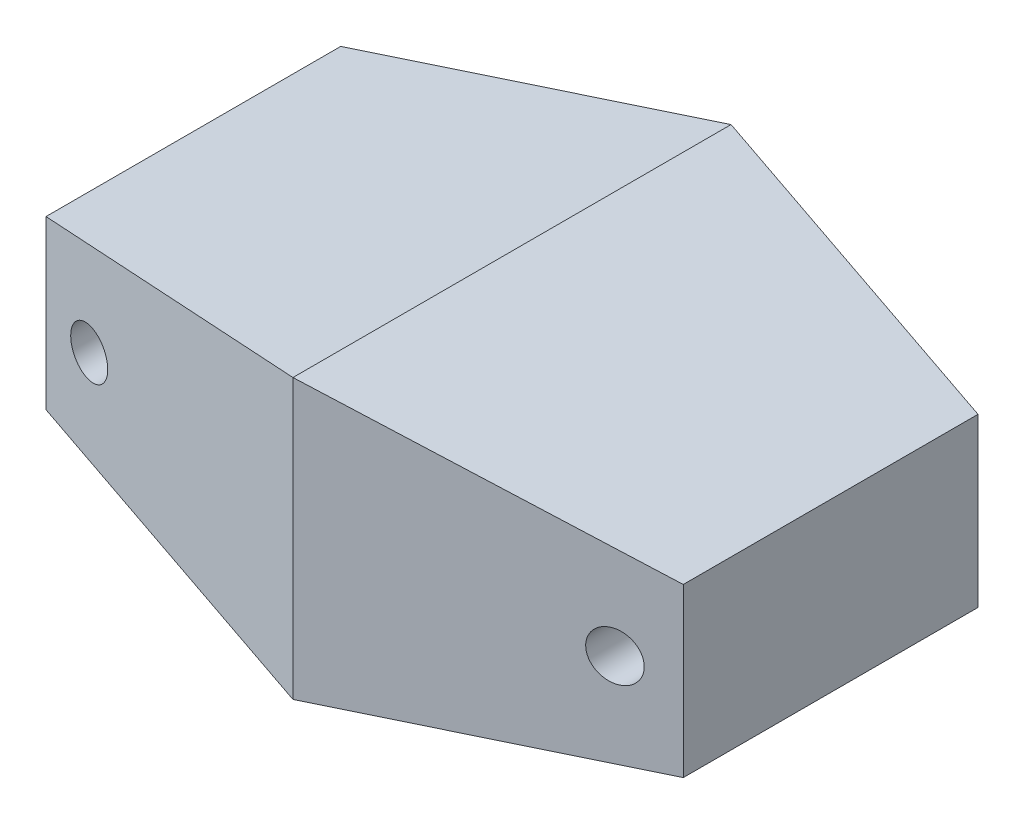
from build123d import *

# Parameters (mm, degrees)
SKETCH1_W               = 80
SKETCH1_H               = 35
BOSS_EXTRUDE1_DEPTH     = 55
CUT_EXTRUDE1_DEPTH      = 55
CUT_EXTRUDE2_DEPTH      = 71.222859526
CUT_EXTRUDE2_DEPTH_BACK = 71.222859526
CUT_EXTRUDE3_DEPTH      = 71.222859526
CUT_EXTRUDE3_DEPTH_BACK = 71.222859526
SKETCH6_R               = 3


with BuildPart() as part:
    # Sketch1 → Boss-Extrude1 (new body)
    with BuildSketch(Plane.XY):
        Rectangle(SKETCH1_W, SKETCH1_H)
    extrude(amount=BOSS_EXTRUDE1_DEPTH)

    # Sketch2 → Cut-Extrude1 (cut)
    with BuildSketch(Plane(origin=(0, 17.5, 0), x_dir=(1, 0, 0), z_dir=(0, 1, 0))):
        Polygon((-40, -55), (0, -55), (-40, -46), align=None)
        Polygon((40, -46), (0, -55), (40, -55), align=None)
        Polygon((0, 0), (40, -9), (40, 0), align=None)
        Polygon((-40, 0), (-40, -9), (0, 0), align=None)
    extrude(amount=-CUT_EXTRUDE1_DEPTH, mode=Mode.SUBTRACT)

    # Sketch5 → Cut-Extrude2 (cut, two sides: drawn at the far end of the back side and taken through both)
    with BuildSketch(Plane.XY.offset(-CUT_EXTRUDE2_DEPTH_BACK)):
        Polygon((40, 17.5), (40, 10.5), (0, 17.5), align=None)
        Polygon((-40, 17.5), (0, 17.5), (-40, 10.5), align=None)
        Polygon((40, -17.5), (0, -17.5), (40, -10.5), align=None)
        Polygon((-40, -10.5), (-40, -17.5), (0, -17.5), align=None)
    extrude(amount=CUT_EXTRUDE2_DEPTH + CUT_EXTRUDE2_DEPTH_BACK, mode=Mode.SUBTRACT)

    # Sketch6 → Cut-Extrude3 (cut, two sides: drawn at the far end of the back side and taken through both)
    with BuildSketch(Plane.XY.offset(-CUT_EXTRUDE3_DEPTH_BACK)):
        with Locations((-33, 0)):
            Circle(SKETCH6_R)
        with Locations((33, 0)):
            Circle(SKETCH6_R)
    extrude(amount=CUT_EXTRUDE3_DEPTH + CUT_EXTRUDE3_DEPTH_BACK, mode=Mode.SUBTRACT)


solid = part.part
